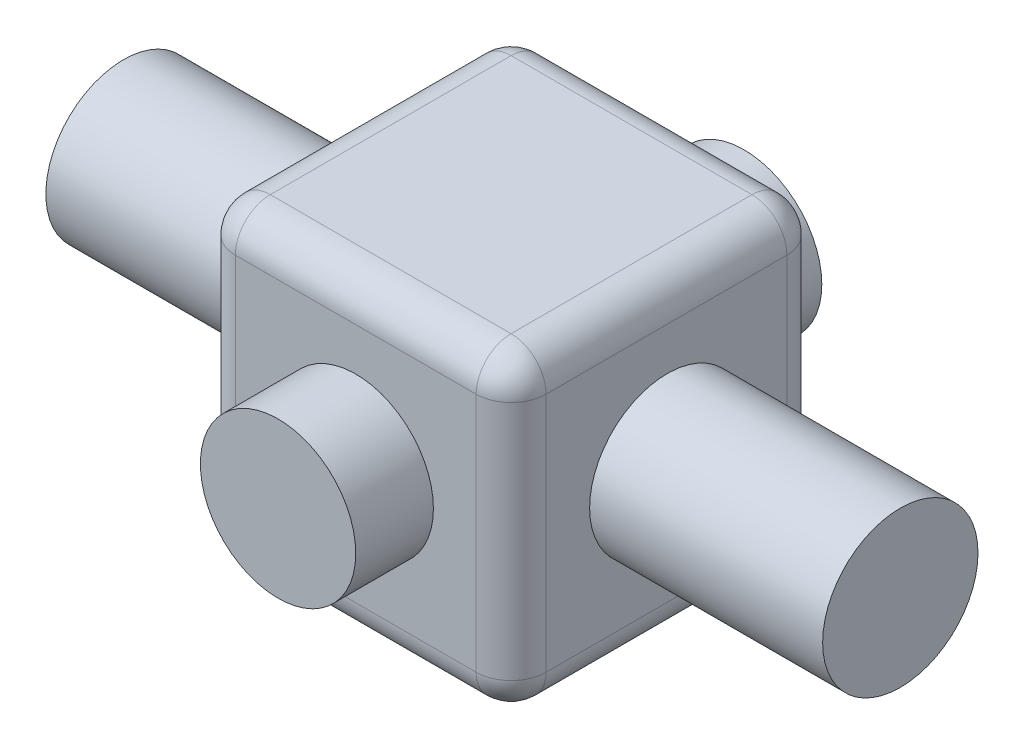
from build123d import *

# Parameters (mm, degrees)
SKETCH1_W                = 8
SKETCH1_H                = 8
BOSS_EXTRUDE1_DEPTH      = 8
FILLET1_R                = 0.9
BOSS_EXTRUDE2_DEPTH      = 2
BOSS_EXTRUDE2_DEPTH_BACK = 10
SKETCH2_R                = 2
SKETCH4_R                = 2
BOSS_EXTRUDE6_DEPTH      = 10


with BuildPart() as part:
    # Sketch1 → Boss-Extrude1 (new body)
    with BuildSketch(Plane.XY):
        Rectangle(SKETCH1_W, SKETCH1_H)
    extrude(amount=BOSS_EXTRUDE1_DEPTH)

    # Fillet1
    fillet1_edges = [part.edges().sort_by_distance(p)[0] for p in [
        (4, 0, 8),
        (0, 4, 8),
        (-4, 0, 8),
        (0, 4, 0),
        (4, 0, 0),
        (0, -4, 0),
        (-4, 0, 0),
        (0, -4, 8),
        (-4, 4, 4),
        (4, 4, 4),
        (4, -4, 4),
        (-4, -4, 4),
    ]]
    fillet(fillet1_edges, radius=FILLET1_R)

    # Sketch2 → Boss-Extrude2 (add, two sides: drawn at the far end of the back side and taken through both)
    with BuildSketch(Plane.XY.offset(8).offset(-BOSS_EXTRUDE2_DEPTH_BACK)):
        Circle(SKETCH2_R)
    extrude(amount=BOSS_EXTRUDE2_DEPTH + BOSS_EXTRUDE2_DEPTH_BACK)

    # Sketch4 → Boss-Extrude6 (add, symmetric)
    with BuildSketch(Plane(origin=(0, 0, 0), x_dir=(0, 0, -1), z_dir=(1, 0, 0))):
        with Locations(Location((-3.978609227, 0, 0), (0, 0, 180))):
            Circle(SKETCH4_R)
    extrude(amount=BOSS_EXTRUDE6_DEPTH, both=True)


solid = part.part
